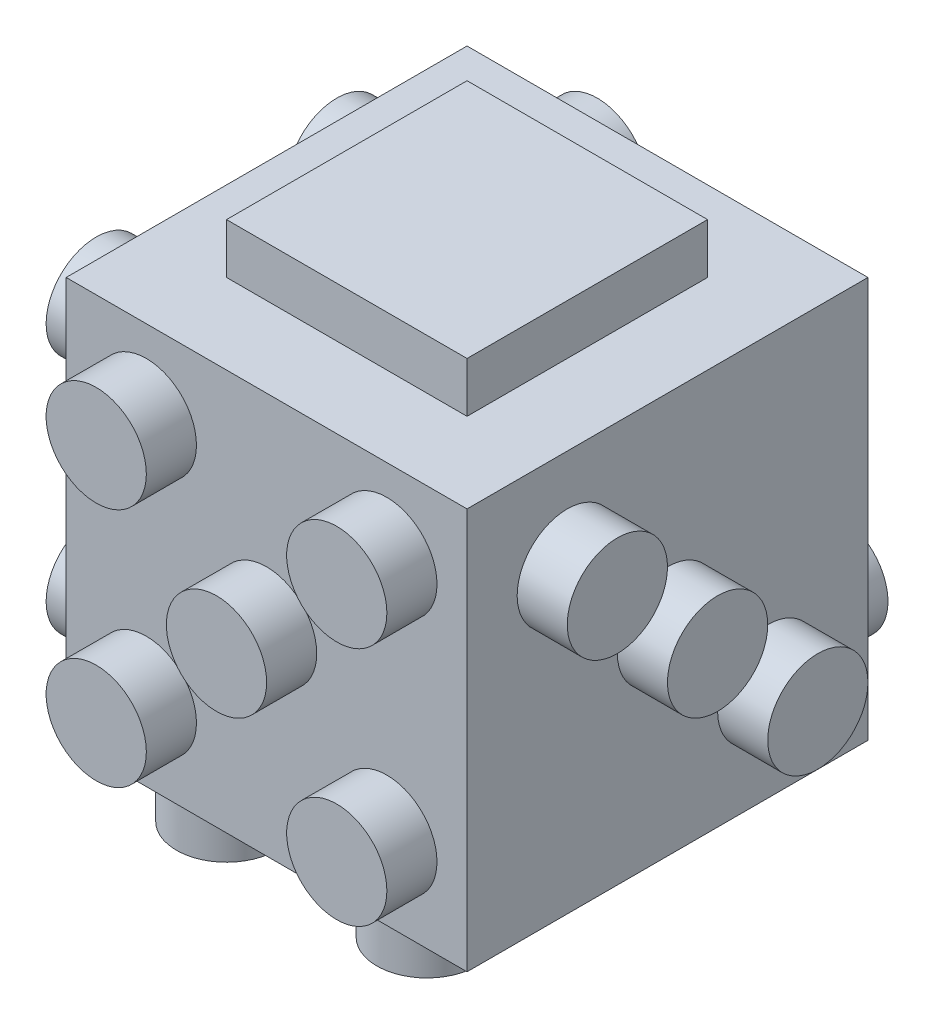
from build123d import *

# Parameters (mm, degrees)
SKETCH1_W             = 25
SKETCH1_H             = 25
BOSS_EXTRUDE1_DEPTH   = 25
SCALE1_SCALE          = 0.8
SKETCH3_R             = 2.5
BOSS_EXTRUDE2_DEPTH   = 2.5
BOSS_EXTRUDE2_2_DEPTH = 2.5
BOSS_EXTRUDE2_3_DEPTH = 2.5
BOSS_EXTRUDE2_4_DEPTH = 2.5
BOSS_EXTRUDE2_5_DEPTH = 2.5
BOSS_EXTRUDE2_6_DEPTH = 2.5
SKETCH7_R             = 2.5
BOSS_EXTRUDE3_DEPTH   = 2.5
SKETCH5_R             = 2.5
BOSS_EXTRUDE4_DEPTH   = 2.5
SKETCH4_R             = 2.5
BOSS_EXTRUDE5_DEPTH   = 2.5
BOSS_EXTRUDE6_START   = -2.5
SKETCH8_R             = 2.5
BOSS_EXTRUDE6_DEPTH   = 2.5
SKETCH2_W             = 12
SKETCH2_H             = 12
BOSS_EXTRUDE7_DEPTH   = 2.5


with BuildPart() as part:
    # Sketch1 → Boss-Extrude1 (new body)
    with BuildSketch(Plane(origin=(0, 0, 0), x_dir=(1, 0, 0), z_dir=(0, 1, 0))):
        Rectangle(SKETCH1_W, SKETCH1_H)
    extrude(amount=BOSS_EXTRUDE1_DEPTH)


with BuildPart() as part_1:
    # Scale1: scaled about (0, 12.5, 0)
    add(part.part.scale(SCALE1_SCALE).moved(Location((0, 2.5, 0))))

    # Sketch7 → Boss-Extrude3 (add)
    with BuildSketch(Plane.XY.offset(12.5)):
        with Locations((-6, 18.5)):
            Circle(SKETCH7_R)
        with Locations((0, 12.5)):
            Circle(SKETCH7_R)
        with Locations((6, 18.5)):
            Circle(SKETCH7_R)
        with Locations((6, 6.5)):
            Circle(SKETCH7_R)
        with Locations((-6, 6.5)):
            Circle(SKETCH7_R)
    extrude(amount=-BOSS_EXTRUDE3_DEPTH)

    # Sketch5 → Boss-Extrude4 (add)
    with BuildSketch(Plane.ZY.offset(12.5)):
        with Locations((-6, 18.5)):
            Circle(SKETCH5_R)
        with Locations((6, 18.5)):
            Circle(SKETCH5_R)
        with Locations((6, 6.5)):
            Circle(SKETCH5_R)
        with Locations((-6, 6.5)):
            Circle(SKETCH5_R)
    extrude(amount=-BOSS_EXTRUDE4_DEPTH)

    # Sketch4 → Boss-Extrude5 (add)
    with BuildSketch(Plane(origin=(12.5, 0, 0), x_dir=(0, 0, -1), z_dir=(1, 0, 0))):
        with Locations((-5, 17.5)):
            Circle(SKETCH4_R)
        with Locations((0, 12.5)):
            Circle(SKETCH4_R)
        with Locations((5, 7.5)):
            Circle(SKETCH4_R)
    extrude(amount=-BOSS_EXTRUDE5_DEPTH)

    # Sketch8 → Boss-Extrude6 (add)
    with BuildSketch(Plane(origin=(0, 0, -12.5), x_dir=(-1, 0, 0), z_dir=(0, 0, -1)).offset(BOSS_EXTRUDE6_START)):
        with Locations(Location((6, 18.5, 0), (0, 0, 180))):
            Circle(SKETCH8_R)
        with Locations(Location((-6, 6.5, 0), (0, 0, 180))):
            Circle(SKETCH8_R)
    extrude(amount=BOSS_EXTRUDE6_DEPTH)

    # Sketch2 → Boss-Extrude7 (add)
    with BuildSketch(Plane(origin=(0, 25, 0), x_dir=(1, 0, 0), z_dir=(0, 1, 0))):
        Rectangle(SKETCH2_W, SKETCH2_H)
    extrude(amount=-BOSS_EXTRUDE7_DEPTH)


with BuildPart() as body_2:
    # Sketch3 → Boss-Extrude2 (new body)
    with BuildSketch(Plane.XZ):
        with Locations(Location((-5, 7, 0), (0, 0, 270))):
            Circle(SKETCH3_R)
    extrude(amount=-BOSS_EXTRUDE2_DEPTH)


with BuildPart() as body_3:
    # Sketch3 → Boss-Extrude2 2 (new body)
    with BuildSketch(Plane.XZ):
        with Locations(Location((-5, 0, 0), (0, 0, 270))):
            Circle(SKETCH3_R)
    extrude(amount=-BOSS_EXTRUDE2_2_DEPTH)


with BuildPart() as body_4:
    # Sketch3 → Boss-Extrude2 3 (new body)
    with BuildSketch(Plane.XZ):
        with Locations(Location((-5, -7, 0), (0, 0, 270))):
            Circle(SKETCH3_R)
    extrude(amount=-BOSS_EXTRUDE2_3_DEPTH)


with BuildPart() as body_5:
    # Sketch3 → Boss-Extrude2 4 (new body)
    with BuildSketch(Plane.XZ):
        with Locations(Location((5, 7, 0), (0, 0, 270))):
            Circle(SKETCH3_R)
    extrude(amount=-BOSS_EXTRUDE2_4_DEPTH)


with BuildPart() as body_6:
    # Sketch3 → Boss-Extrude2 5 (new body)
    with BuildSketch(Plane.XZ):
        with Locations(Location((5, 0, 0), (0, 0, 270))):
            Circle(SKETCH3_R)
    extrude(amount=-BOSS_EXTRUDE2_5_DEPTH)


with BuildPart() as body_7:
    # Sketch3 → Boss-Extrude2 6 (new body)
    with BuildSketch(Plane.XZ):
        with Locations(Location((5, -7, 0), (0, 0, 270))):
            Circle(SKETCH3_R)
    extrude(amount=-BOSS_EXTRUDE2_6_DEPTH)


solid = Compound([part_1.part, body_2.part, body_3.part, body_4.part, body_5.part, body_6.part, body_7.part])
